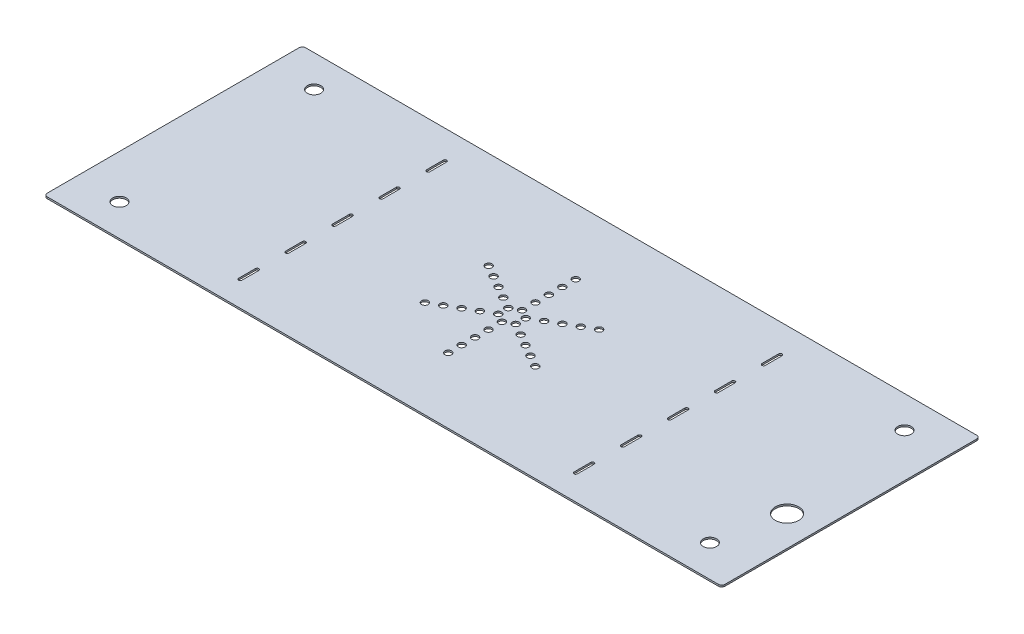
from build123d import *

# Parameters (mm, degrees)
SKETCH_1_R      = 2
SKETCH_1_R_2    = 3.5
SKETCH_1_R_3    = 1
EXTRUDE_2_DEPTH = 0.5


with BuildPart() as part:
    # Эскиз1 → Бобышка-Вытянуть2 (new body)
    with BuildSketch(Plane(origin=(0, 0, 0), x_dir=(1, 0, 0), z_dir=(0, 1, 0))):
        with BuildLine():
            Line((-100, 38.5), (100, 38.5))
            ThreePointArc((100, 38.5), (100.707106781, 38.207106781), (101, 37.5))
            Line((101, 37.5), (101, -37.5))
            ThreePointArc((101, -37.5), (100.707106781, -38.207106781), (100, -38.5))
            Line((100, -38.5), (-100, -38.5))
            ThreePointArc((-100, -38.5), (-100.707106781, -38.207106781), (-101, -37.5))
            Line((-101, -37.5), (-101, 37.5))
            ThreePointArc((-101, 37.5), (-100.707106781, 38.207106781), (-100, 38.5))
        make_face()
        with Locations(Location((-88, 29, 0), (0, 0, 270))):
            Circle(SKETCH_1_R, mode=Mode.SUBTRACT)
        with Locations(Location((88, 29, 0), (0, 0, 270))):
            Circle(SKETCH_1_R, mode=Mode.SUBTRACT)
        with Locations(Location((88, -29, 0), (0, 0, 270))):
            Circle(SKETCH_1_R, mode=Mode.SUBTRACT)
        with Locations(Location((-88, -29, 0), (0, 0, 270))):
            Circle(SKETCH_1_R, mode=Mode.SUBTRACT)
        with Locations(Location((92, -10, 0), (0, 0, 270))):
            Circle(SKETCH_1_R_2, mode=Mode.SUBTRACT)
        with Locations(Location((0, 3, 0), (0, 0, 270))):
            Circle(SKETCH_1_R_3, mode=Mode.SUBTRACT)
        with Locations(Location((0, 7, 0), (0, 0, 270))):
            Circle(SKETCH_1_R_3, mode=Mode.SUBTRACT)
        with Locations(Location((0, 11, 0), (0, 0, 270))):
            Circle(SKETCH_1_R_3, mode=Mode.SUBTRACT)
        with Locations(Location((0, 15, 0), (0, 0, 270))):
            Circle(SKETCH_1_R_3, mode=Mode.SUBTRACT)
        with Locations(Location((0, 19, 0), (0, 0, 270))):
            Circle(SKETCH_1_R_3, mode=Mode.SUBTRACT)
        with Locations(Location((2.598076211, 1.5, 0), (0, 0, 270))):
            Circle(SKETCH_1_R_3, mode=Mode.SUBTRACT)
        with Locations(Location((6.062177826, 3.5, 0), (0, 0, 270))):
            Circle(SKETCH_1_R_3, mode=Mode.SUBTRACT)
        with Locations(Location((9.526279442, 5.5, 0), (0, 0, 270))):
            Circle(SKETCH_1_R_3, mode=Mode.SUBTRACT)
        with Locations(Location((12.990381057, 7.5, 0), (0, 0, 270))):
            Circle(SKETCH_1_R_3, mode=Mode.SUBTRACT)
        with Locations(Location((16.454482672, 9.5, 0), (0, 0, 270))):
            Circle(SKETCH_1_R_3, mode=Mode.SUBTRACT)
        with Locations(Location((2.598076211, -1.5, 0), (0, 0, 270))):
            Circle(SKETCH_1_R_3, mode=Mode.SUBTRACT)
        with Locations(Location((6.062177826, -3.5, 0), (0, 0, 270))):
            Circle(SKETCH_1_R_3, mode=Mode.SUBTRACT)
        with Locations(Location((9.526279442, -5.5, 0), (0, 0, 270))):
            Circle(SKETCH_1_R_3, mode=Mode.SUBTRACT)
        with Locations(Location((12.990381057, -7.5, 0), (0, 0, 270))):
            Circle(SKETCH_1_R_3, mode=Mode.SUBTRACT)
        with Locations(Location((16.454482672, -9.5, 0), (0, 0, 270))):
            Circle(SKETCH_1_R_3, mode=Mode.SUBTRACT)
        with Locations(Location((0, -3, 0), (0, 0, 270))):
            Circle(SKETCH_1_R_3, mode=Mode.SUBTRACT)
        with Locations(Location((0, -7, 0), (0, 0, 270))):
            Circle(SKETCH_1_R_3, mode=Mode.SUBTRACT)
        with Locations(Location((0, -11, 0), (0, 0, 270))):
            Circle(SKETCH_1_R_3, mode=Mode.SUBTRACT)
        with Locations(Location((0, -15, 0), (0, 0, 270))):
            Circle(SKETCH_1_R_3, mode=Mode.SUBTRACT)
        with Locations(Location((0, -19, 0), (0, 0, 270))):
            Circle(SKETCH_1_R_3, mode=Mode.SUBTRACT)
        with Locations(Location((-2.598076211, -1.5, 0), (0, 0, 270))):
            Circle(SKETCH_1_R_3, mode=Mode.SUBTRACT)
        with Locations(Location((-6.062177826, -3.5, 0), (0, 0, 270))):
            Circle(SKETCH_1_R_3, mode=Mode.SUBTRACT)
        with Locations(Location((-9.526279442, -5.5, 0), (0, 0, 270))):
            Circle(SKETCH_1_R_3, mode=Mode.SUBTRACT)
        with Locations(Location((-12.990381057, -7.5, 0), (0, 0, 270))):
            Circle(SKETCH_1_R_3, mode=Mode.SUBTRACT)
        with Locations(Location((-16.454482672, -9.5, 0), (0, 0, 270))):
            Circle(SKETCH_1_R_3, mode=Mode.SUBTRACT)
        with Locations(Location((-2.598076211, 1.5, 0), (0, 0, 270))):
            Circle(SKETCH_1_R_3, mode=Mode.SUBTRACT)
        with Locations(Location((-6.062177826, 3.5, 0), (0, 0, 270))):
            Circle(SKETCH_1_R_3, mode=Mode.SUBTRACT)
        with Locations(Location((-9.526279442, 5.5, 0), (0, 0, 270))):
            Circle(SKETCH_1_R_3, mode=Mode.SUBTRACT)
        with Locations(Location((-12.990381057, 7.5, 0), (0, 0, 270))):
            Circle(SKETCH_1_R_3, mode=Mode.SUBTRACT)
        with Locations(Location((-16.454482672, 9.5, 0), (0, 0, 270))):
            Circle(SKETCH_1_R_3, mode=Mode.SUBTRACT)
        with BuildLine():
            Line((-50.5, -31), (-50.5, -26))
            ThreePointArc((-50.5, -26), (-50, -25.5), (-49.5, -26))
            Line((-49.5, -26), (-49.5, -31))
            ThreePointArc((-49.5, -31), (-50, -31.5), (-50.5, -31))
        make_face(mode=Mode.SUBTRACT)
        with BuildLine():
            Line((-50.5, -17), (-50.5, -12))
            ThreePointArc((-50.5, -12), (-50, -11.5), (-49.5, -12))
            Line((-49.5, -12), (-49.5, -17))
            ThreePointArc((-49.5, -17), (-50, -17.5), (-50.5, -17))
        make_face(mode=Mode.SUBTRACT)
        with BuildLine():
            Line((49.5, -31), (49.5, -26))
            ThreePointArc((49.5, -26), (50, -25.5), (50.5, -26))
            Line((50.5, -26), (50.5, -31))
            ThreePointArc((50.5, -31), (50, -31.5), (49.5, -31))
        make_face(mode=Mode.SUBTRACT)
        with BuildLine():
            Line((49.5, -17), (49.5, -12))
            ThreePointArc((49.5, -12), (50, -11.5), (50.5, -12))
            Line((50.5, -12), (50.5, -17))
            ThreePointArc((50.5, -17), (50, -17.5), (49.5, -17))
        make_face(mode=Mode.SUBTRACT)
        with BuildLine():
            Line((49.5, -3), (49.5, 2))
            ThreePointArc((49.5, 2), (50, 2.5), (50.5, 2))
            Line((50.5, 2), (50.5, -3))
            ThreePointArc((50.5, -3), (50, -3.5), (49.5, -3))
        make_face(mode=Mode.SUBTRACT)
        with BuildLine():
            Line((49.5, 11), (49.5, 16))
            ThreePointArc((49.5, 16), (50, 16.5), (50.5, 16))
            Line((50.5, 16), (50.5, 11))
            ThreePointArc((50.5, 11), (50, 10.5), (49.5, 11))
        make_face(mode=Mode.SUBTRACT)
        with BuildLine():
            Line((49.5, 25), (49.5, 30))
            ThreePointArc((49.5, 30), (50, 30.5), (50.5, 30))
            Line((50.5, 30), (50.5, 25))
            ThreePointArc((50.5, 25), (50, 24.5), (49.5, 25))
        make_face(mode=Mode.SUBTRACT)
        with BuildLine():
            Line((-50.5, -3), (-50.5, 2))
            ThreePointArc((-50.5, 2), (-50, 2.5), (-49.5, 2))
            Line((-49.5, 2), (-49.5, -3))
            ThreePointArc((-49.5, -3), (-50, -3.5), (-50.5, -3))
        make_face(mode=Mode.SUBTRACT)
        with BuildLine():
            Line((-50.5, 11), (-50.5, 16))
            ThreePointArc((-50.5, 16), (-50, 16.5), (-49.5, 16))
            Line((-49.5, 16), (-49.5, 11))
            ThreePointArc((-49.5, 11), (-50, 10.5), (-50.5, 11))
        make_face(mode=Mode.SUBTRACT)
        with BuildLine():
            Line((-50.5, 25), (-50.5, 30))
            ThreePointArc((-50.5, 30), (-50, 30.5), (-49.5, 30))
            Line((-49.5, 30), (-49.5, 25))
            ThreePointArc((-49.5, 25), (-50, 24.5), (-50.5, 25))
        make_face(mode=Mode.SUBTRACT)
    extrude(amount=EXTRUDE_2_DEPTH)


solid = part.part
